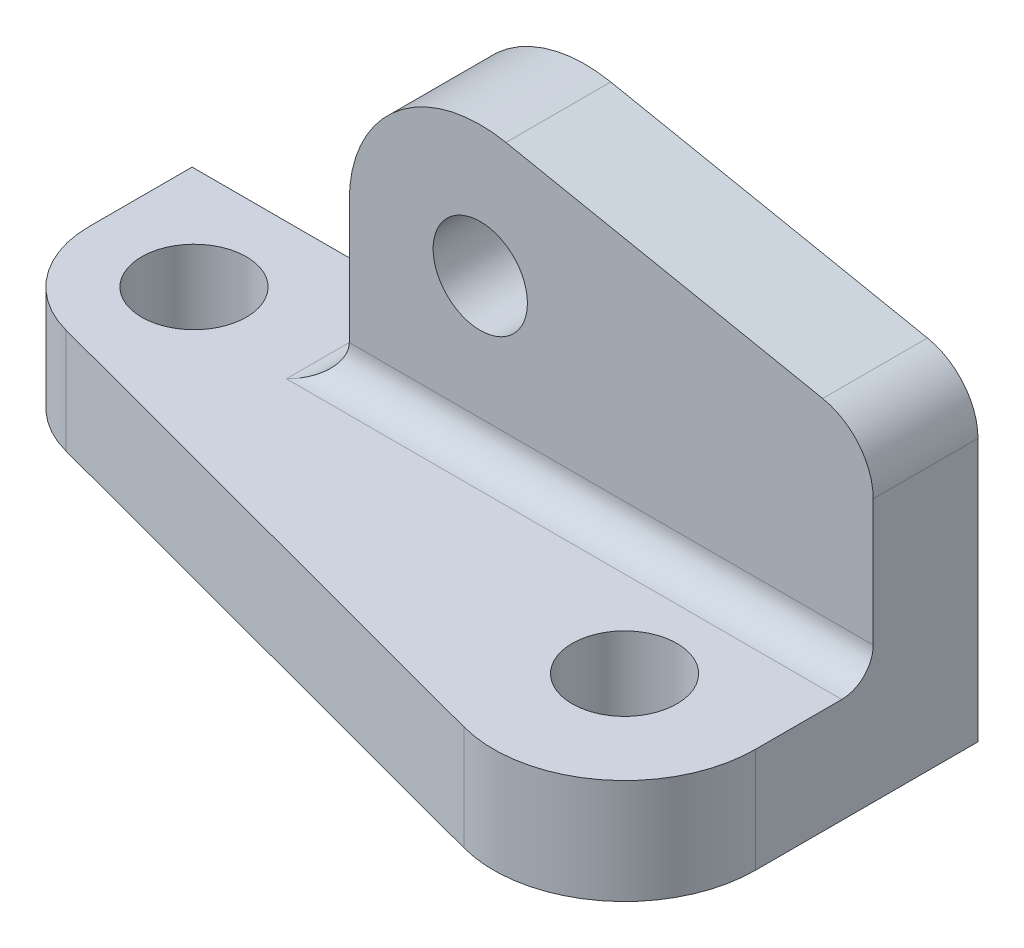
from build123d import *

# Parameters (mm, degrees)
EXTRUDE1_DEPTH            = 20
EXTRUDE2_DEPTH            = 20
FILLET1_R                 = 25
FILLET2_R                 = 20
FILLET3_R                 = 12
FILLET4_R                 = 6
M20_0_20_DIAMETER_HOLE1_D = 20
M18_0_18_DIAMETER_HOLE1_D = 18


with BuildPart() as part:
    # Sketch1 → Extrude1 (new body)
    with BuildSketch(Plane(origin=(0, 0, 0), x_dir=(1, 0, 0), z_dir=(0, 1, 0))):
        Polygon((0, 0), (150, 0), (150, -75), (0, -35), align=None)
    extrude(amount=EXTRUDE1_DEPTH)

    # Sketch2 → Extrude2 (add)
    with BuildSketch(Plane(origin=(0, 0, 0), x_dir=(-1, 0, 0), z_dir=(0, 0, -1))):
        Polygon((-150, 0), (-50, 0), (-50, 80), (-150, 60), align=None)
    extrude(amount=-EXTRUDE2_DEPTH)

    # Fillet1
    fillet1_edges = [part.edges().sort_by_distance(p)[0] for p in [
        (50, 80, 10),
        (150, 10, 75),
    ]]
    fillet(fillet1_edges, radius=FILLET1_R)

    # Fillet2
    fillet2_edges = [part.edges().sort_by_distance(p)[0] for p in [
        (0, 10, 35),
    ]]
    fillet(fillet2_edges, radius=FILLET2_R)

    # Fillet3
    fillet3_edges = [part.edges().sort_by_distance(p)[0] for p in [
        (150, 60, 10),
    ]]
    fillet(fillet3_edges, radius=FILLET3_R)

    # Fillet4
    fillet4_edges = [part.edges().sort_by_distance(p)[0] for p in [
        (50, 20, 10),
        (100, 20, 20),
    ]]
    fillet(fillet4_edges, radius=FILLET4_R)

    # M20.0 (20) Diameter Hole1 (through all)
    with Locations(Plane(origin=(0, 20, 0), x_dir=(-1, 0, 0), z_dir=(0, 1, 0))):
        with Locations((-125, 42.45970884), (-20, 19.634433738)):
            Hole(M20_0_20_DIAMETER_HOLE1_D / 2)

    # M18.0 (18) Diameter Hole1 (through all)
    with Locations(Plane(origin=(130.879919851, 20.264222767, 20), x_dir=(1, 0, 0), z_dir=(0, 0, 1))):
        with Locations((-55.879919851, 29.240679665)):
            Hole(M18_0_18_DIAMETER_HOLE1_D / 2)


solid = part.part
